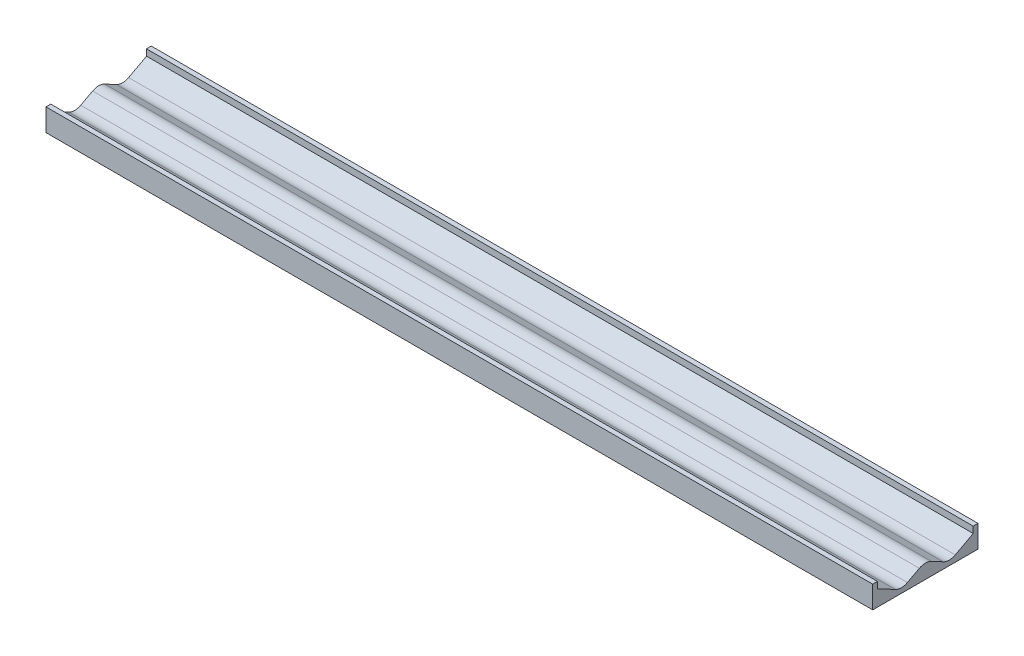
from build123d import *

# Parameters (mm, degrees)
IZIM1_W                     = 259.05
IZIM1_H                     = 33
Y_KSEKLIK_EKSTR_ZYON1_DEPTH = 7
IZIM2_W                     = 30
IZIM2_H                     = 2
KES_EKSTR_ZYON1_DEPTH       = 291
KES_EKSTR_ZYON2_DEPTH       = 291


with BuildPart() as part:
    # Çizim1 → Yükseklik-Ekstrüzyon1 (new body)
    with BuildSketch(Plane(origin=(0, 0, 0), x_dir=(1, 0, 0), z_dir=(0, 1, 0))):
        Rectangle(IZIM1_W, IZIM1_H)
    extrude(amount=Y_KSEKLIK_EKSTR_ZYON1_DEPTH)

    # Çizim2 → Kes-Ekstrüzyon1 (cut)
    with BuildSketch(Plane(origin=(129.525, 0, 0), x_dir=(0, 0, -1), z_dir=(1, 0, 0))):
        with Locations((0, 6)):
            Rectangle(IZIM2_W, IZIM2_H)
    extrude(amount=-KES_EKSTR_ZYON1_DEPTH, mode=Mode.SUBTRACT)

    # Çizim3 → Kes-Ekstrüzyon2 (cut)
    with BuildSketch(Plane(origin=(129.525, 0, 0), x_dir=(0, 0, -1), z_dir=(1, 0, 0))):
        with BuildLine():
            Line((-15, 5), (15, 5))
            Line((15, 5), (9.382352941, 2.003921569))
            ThreePointArc((9.382352941, 2.003921569), (7.5, 1.533333333), (5.617647059, 2.003921569))
            Line((5.617647059, 2.003921569), (1.882352941, 3.996078431))
            ThreePointArc((1.882352941, 3.996078431), (0, 4.466666667), (-1.882352941, 3.996078431))
            Line((-1.882352941, 3.996078431), (-5.617647059, 2.003921569))
            ThreePointArc((-5.617647059, 2.003921569), (-7.5, 1.533333333), (-9.382352941, 2.003921569))
            Line((-9.382352941, 2.003921569), (-15, 5))
        make_face()
    extrude(amount=-KES_EKSTR_ZYON2_DEPTH, mode=Mode.SUBTRACT)


solid = part.part
